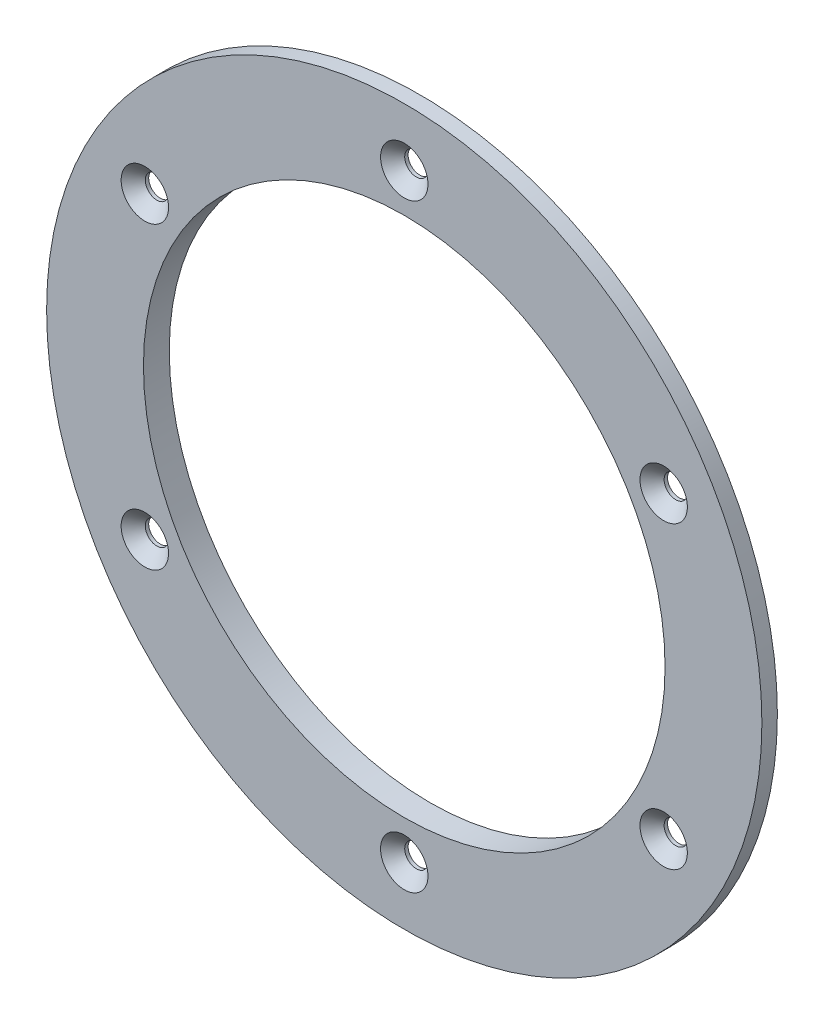
from build123d import *
from build123d.topology import SkipClean

# Parameters (mm, degrees)
SKETCH1_R           = 69.25
SKETCH1_R_2         = 50.5
EXTRUDE1_DEPTH      = 3
SKETCH2_R           = 2
CUT_EXTRUDE1_DEPTH  = 10
CIRPATTERN1_COUNT   = 6
BOSS_EXTRUDE1_START = 2
SKETCH4_R           = 52.5
SKETCH4_R_2         = 50.5
BOSS_EXTRUDE1_DEPTH = 2


with BuildPart() as part:
    # Sketch1 → Extrude1 (new body)
    with BuildSketch(Plane.XY):
        Circle(SKETCH1_R)
        Circle(SKETCH1_R_2, mode=Mode.SUBTRACT)
    extrude(amount=EXTRUDE1_DEPTH)

    # Sketch2 → Cut-Extrude1 (cut)
    with BuildSketch(Plane.XY.offset(3)):
        with Locations((0, 58)):
            Circle(SKETCH2_R)
    extrude(amount=-CUT_EXTRUDE1_DEPTH, mode=Mode.SUBTRACT)

    # Sketch3 → CSK for M4 Hex Socket Countersunk Head Screw1 (revolve, cut)
    with BuildSketch(Plane(origin=(0, 58, 3), x_dir=(0, -1, 0), z_dir=(1, 0, 0))):
        Polygon((0, 0), (0, 3), (2.25, 3), (2.25, 2.34), (4.59, 0), align=None)
    csk_for_m4_hex_socket_countersunk_head_s = revolve(axis=Axis((0, 58, 9.35), (0, 0, -1)), mode=Mode.SUBTRACT)

    # CirPattern1: CSK for M4 Hex Socket Countersunk Head Screw1 ×6 about axis
    cirpattern1_axis = Axis((0, 0, 3), (0, 0, -1))
    for i in range(1, CIRPATTERN1_COUNT):
        add(csk_for_m4_hex_socket_countersunk_head_s.rotate(cirpattern1_axis, i * 360 / CIRPATTERN1_COUNT), mode=Mode.SUBTRACT)

    # Sketch4 → Boss-Extrude1 (add)
    with SkipClean():  # the faces are left unmerged after this step: merging them gives an invalid solid
        with BuildSketch(Plane(origin=(0, 0, 0), x_dir=(-1, 0, 0), z_dir=(0, 0, -1)).offset(BOSS_EXTRUDE1_START)):
            Circle(SKETCH4_R)
            Circle(SKETCH4_R_2, mode=Mode.SUBTRACT)
        extrude(amount=-BOSS_EXTRUDE1_DEPTH)


solid = part.part
